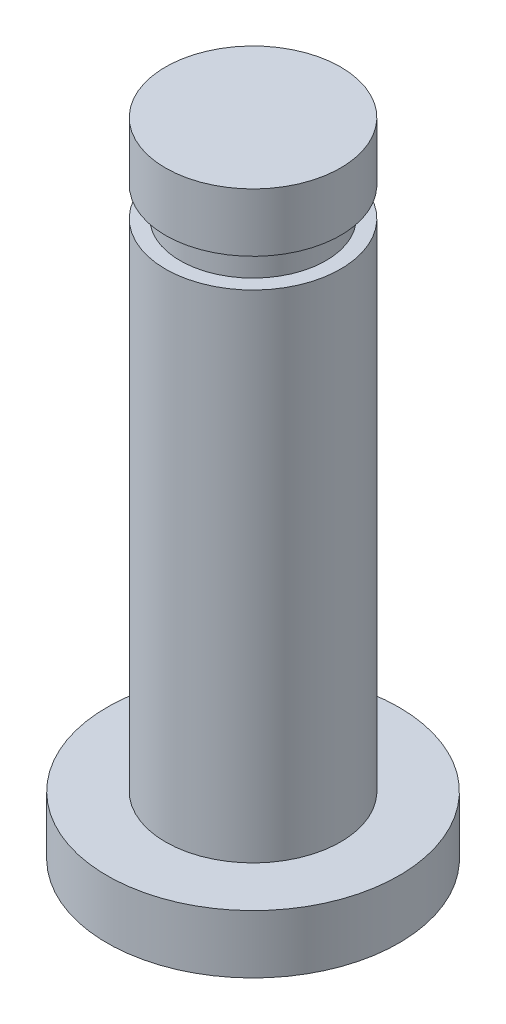
from build123d import *


with BuildPart() as part:
    # 草图1 → 旋转1 (revolve)
    with BuildSketch(Plane.XY, mode=Mode.PRIVATE) as revolve_1_sk:
        Polygon((3, 0), (3, 17), (2.5, 17), (2.5, 18), (3, 18), (3, 20), (0, 20), (0, -2), (5, -2), (5, 0), align=None)
    revolve(revolve_1_sk.sketch.rotate(Axis((0, 0, 0), (0, 1, 0)), 90), axis=Axis((0, 0, 0), (0, 1, 0)))


solid = part.part
